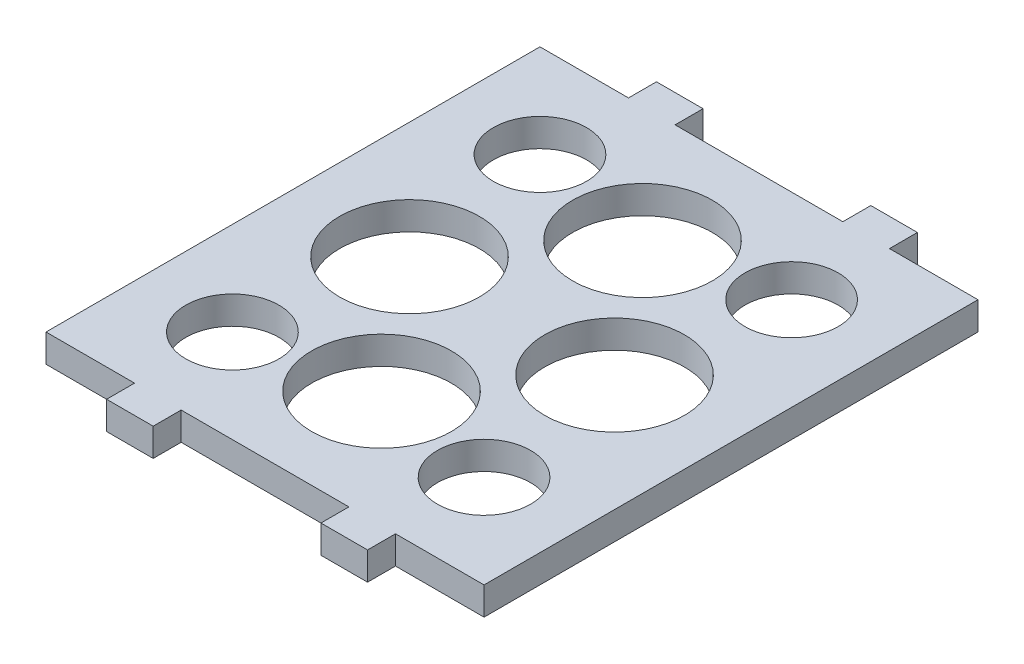
from build123d import *

# Parameters (mm, degrees)
SKETCH1_R           = 15
SKETCH1_R_2         = 10
BOSS_EXTRUDE1_DEPTH = 6


with BuildPart() as part:
    # Sketch1 → Boss-Extrude1 (new body)
    with BuildSketch(Plane(origin=(0, 0, 0), x_dir=(1, 0, 0), z_dir=(0, 1, 0))):
        Polygon((0, 0), (19, 0), (19, -6), (29, -6), (29, 0), (65, 0), (65, -6), (75, -6), (75, 0), (94, 0), (94, 106), (75, 106), (75, 112), (65, 112), (65, 106), (29, 106), (29, 112), (19, 112), (19, 106), (0, 106), align=None)
        with Locations(Location((25, 53, 0), (0, 0, 270))):
            Circle(SKETCH1_R, mode=Mode.SUBTRACT)
        with Locations(Location((69, 53, 0), (0, 0, 270))):
            Circle(SKETCH1_R, mode=Mode.SUBTRACT)
        with Locations(Location((47, 81, 0), (0, 0, 270))):
            Circle(SKETCH1_R, mode=Mode.SUBTRACT)
        with Locations(Location((47, 25, 0), (0, 0, 270))):
            Circle(SKETCH1_R, mode=Mode.SUBTRACT)
        with Locations(Location((20, 20, 0), (0, 0, 270))):
            Circle(SKETCH1_R_2, mode=Mode.SUBTRACT)
        with Locations(Location((20, 86, 0), (0, 0, 270))):
            Circle(SKETCH1_R_2, mode=Mode.SUBTRACT)
        with Locations(Location((74, 86, 0), (0, 0, 270))):
            Circle(SKETCH1_R_2, mode=Mode.SUBTRACT)
        with Locations(Location((74, 20, 0), (0, 0, 270))):
            Circle(SKETCH1_R_2, mode=Mode.SUBTRACT)
    extrude(amount=BOSS_EXTRUDE1_DEPTH)


solid = part.part
